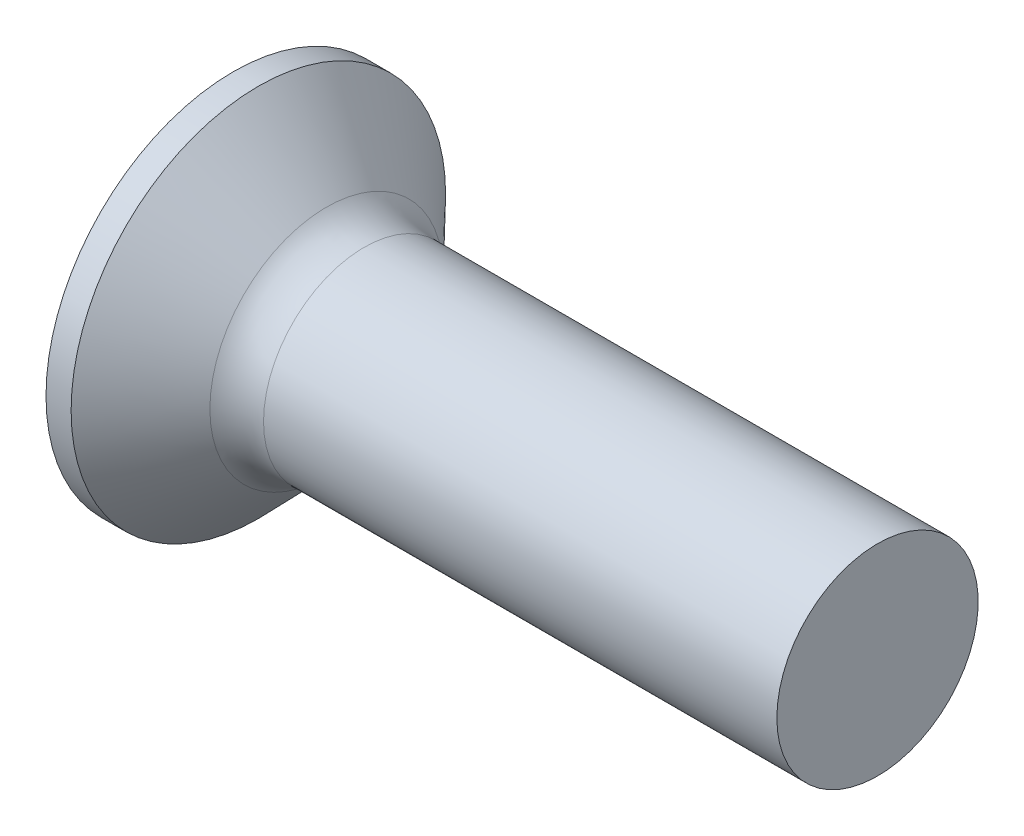
from build123d import *

# Parameters (mm, degrees)
FILLET1_R    = 1.3
RECPAT_COUNT = 2
RECPAT_ANGLE = 90


with BuildPart() as part:
    # BodySke → Base-Revolve (revolve)
    with BuildSketch(Plane.XY, mode=Mode.PRIVATE) as base_revolve_sk:
        Polygon((0, 0), (0, 4.65), (0.623769134, 4.65), (2.7, 2.5), (16, 2.5), (16, 0), align=None)
    revolve(base_revolve_sk.sketch.rotate(Axis((-6.35, 0, 0), (1, 0, 0)), 90), axis=Axis((-6.35, 0, 0), (1, 0, 0)))

    # Fillet1
    fillet1_edges = [part.edges().sort_by_distance(p)[0] for p in [
        (2.7, 0, -2.5),
    ]]
    fillet(fillet1_edges, radius=FILLET1_R)

    # Sketch3 → Recess section 0
    with BuildSketch(Plane.ZY):
        with BuildLine():
            Line((-0.515, 2.45), (0.515, 2.45))
            Line((0.515, 2.45), (0.515, -2.45))
            Line((0.515, -2.45), (-0.515, -2.45))
            Line((-0.515, -2.45), (-0.515, 2.45))
        make_face()
    # Sketch4 → Recess section 1
    with BuildSketch(Plane.ZY.offset(-3.05)):
        with BuildLine():
            Line((-0.515, 0.929326148), (0.515, 0.929326148))
            Line((0.515, 0.929326148), (0.515, -0.929326148))
            Line((0.515, -0.929326148), (-0.515, -0.929326148))
            Line((-0.515, -0.929326148), (-0.515, 0.929326148))
        make_face()
    recess = loft(mode=Mode.SUBTRACT)

    # RecPat: Recess ×2 about axis
    recpat_axis = Axis((-6.35, 0, 0), (1, 0, 0))
    for i in range(1, RECPAT_COUNT):
        add(recess.rotate(recpat_axis, i * RECPAT_ANGLE / (RECPAT_COUNT - 1)), mode=Mode.SUBTRACT)

    # RecCorSke → RecessCore (revolve, cut)
    with BuildSketch(Plane.XY, mode=Mode.PRIVATE) as recesscore_sk:
        Polygon((0, 0), (0, 1.064276776), (3.05, 0.851), (3.326506661, 0), align=None)
    revolve(recesscore_sk.sketch.rotate(Axis((-3.175, 0, 0), (1, 0, 0)), 90), axis=Axis((-3.175, 0, 0), (1, 0, 0)), mode=Mode.SUBTRACT)


solid = part.part
